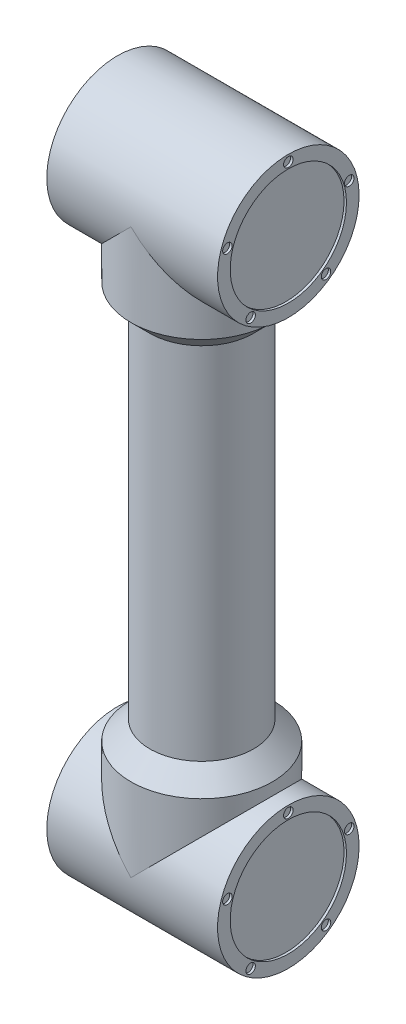
from build123d import *

# Parameters (mm, degrees)
SALIENTE_EXTRUIR2_DEPTH      = 69
SALIENTE_EXTRUIR2_DEPTH_BACK = 69
CROQUIS3_R                   = 58
CROQUIS5_R                   = 58
CROQUIS5_R_2                 = 47.65301306
CROQUIS5_R_3                 = 3.895689101
SALIENTE_EXTRUIR3_DEPTH      = 2


with BuildPart() as part:
    # Croquis2 → Revolución1 (revolve)
    with BuildSketch(Plane.XY):
        Polygon((0, 0), (-58, 0), (-58, 68), (-42.5, 83.579391827), (-42.5, 378.579391827), (-58, 394.000404577), (-58, 462.000404577), (0, 462.000404577), align=None)
    revolve(axis=Axis((0, 462.000404577, 0), (0, -1, 0)))

    # Croquis3 → Saliente-Extruir2 (add, two sides: drawn at the far end of the back side and taken through both)
    with BuildSketch(Plane(origin=(0, 0, 0), x_dir=(0, 0, -1), z_dir=(1, 0, 0)).offset(-SALIENTE_EXTRUIR2_DEPTH_BACK)):
        with Locations((0, 462.000404577)):
            Circle(CROQUIS3_R)
        Circle(CROQUIS3_R)
    extrude(amount=SALIENTE_EXTRUIR2_DEPTH + SALIENTE_EXTRUIR2_DEPTH_BACK)

    # Croquis5 → Saliente-Extruir3 (add)
    # profile 1 of 2: a face of its own
    with BuildSketch(Plane(origin=(69, 0, 0), x_dir=(0, 0, -1), z_dir=(1, 0, 0))):
        Circle(CROQUIS5_R)
        Circle(CROQUIS5_R_2, mode=Mode.SUBTRACT)
        with Locations((0, 52.526315759)):
            Circle(CROQUIS5_R_3, mode=Mode.SUBTRACT)
        with Locations((49.95549488, 16.231524222)):
            Circle(CROQUIS5_R_3, mode=Mode.SUBTRACT)
        with Locations((30.874193761, -42.494682101)):
            Circle(CROQUIS5_R_3, mode=Mode.SUBTRACT)
        with Locations((-30.874193761, -42.494682101)):
            Circle(CROQUIS5_R_3, mode=Mode.SUBTRACT)
        with Locations((-49.95549488, 16.231524222)):
            Circle(CROQUIS5_R_3, mode=Mode.SUBTRACT)
    # profile 2 of 2: a face of its own
    with BuildSketch(Plane(origin=(69, 0, 0), x_dir=(0, 0, -1), z_dir=(1, 0, 0))):
        with Locations((0, 462.000404577)):
            Circle(CROQUIS5_R)
        with Locations((0, 462.000404577)):
            Circle(CROQUIS5_R_2, mode=Mode.SUBTRACT)
        with Locations((-49.95549488, 478.231928798)):
            Circle(CROQUIS5_R_3, mode=Mode.SUBTRACT)
        with Locations((0, 514.526720336)):
            Circle(CROQUIS5_R_3, mode=Mode.SUBTRACT)
        with Locations((30.874193761, 419.505722476)):
            Circle(CROQUIS5_R_3, mode=Mode.SUBTRACT)
        with Locations((-30.874193761, 419.505722476)):
            Circle(CROQUIS5_R_3, mode=Mode.SUBTRACT)
        with Locations((49.95549488, 476.231524222)):
            Circle(CROQUIS5_R_3, mode=Mode.SUBTRACT)
    extrude(amount=SALIENTE_EXTRUIR3_DEPTH)


solid = part.part
